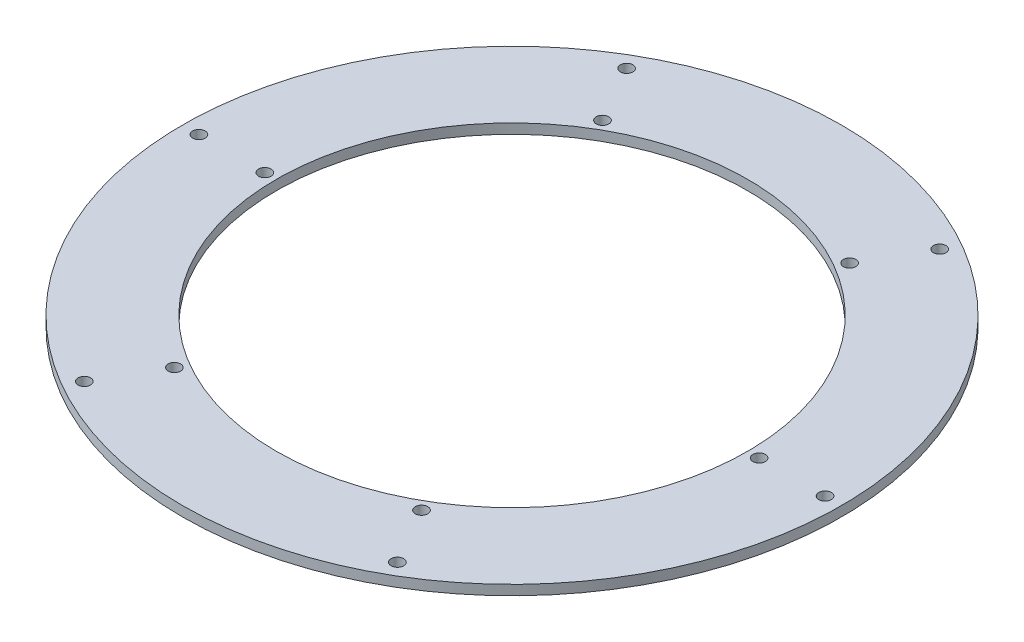
from build123d import *

# Parameters (mm, degrees)
IZIM1_R                     = 100
IZIM1_R_2                   = 71.5
Y_KSEKLIK_EKSTR_ZYON1_DEPTH = 3
IZIM2_R                     = 1.9
KES_EKSTR_ZYON1_DEPTH       = 142.453172464
DAIRESEL_KAPLAMA1_COUNT     = 6


with BuildPart() as part:
    # Çizim1 → Yükseklik-Ekstrüzyon1 (new body)
    with BuildSketch(Plane(origin=(0, 0, 0), x_dir=(1, 0, 0), z_dir=(0, 1, 0))):
        with Locations(Location((0, 0, 0), (0, 0, 270))):
            Circle(IZIM1_R)
        with Locations(Location((0, 0, 0), (0, 0, 270))):
            Circle(IZIM1_R_2, mode=Mode.SUBTRACT)
    extrude(amount=Y_KSEKLIK_EKSTR_ZYON1_DEPTH)

    # Çizim2 → Kes-Ekstrüzyon1 (cut, symmetric)
    with BuildSketch(Plane(origin=(0, 3, 0), x_dir=(1, 0, 0), z_dir=(0, 1, 0))):
        with Locations(Location((-95, 0, 0), (0, 0, 270))):
            Circle(IZIM2_R)
        with Locations(Location((-75, 0, 0), (0, 0, 270))):
            Circle(IZIM2_R)
    kes_ekstr_zyon1 = extrude(amount=KES_EKSTR_ZYON1_DEPTH, both=True, mode=Mode.SUBTRACT)

    # Dairesel Kaplama1: Kes-Ekstrüzyon1 ×6 about axis
    dairesel_kaplama1_axis = Axis((0, 0, 0), (0, 1, 0))
    for i in range(1, DAIRESEL_KAPLAMA1_COUNT):
        add(kes_ekstr_zyon1.rotate(dairesel_kaplama1_axis, i * 360 / DAIRESEL_KAPLAMA1_COUNT), mode=Mode.SUBTRACT)


solid = part.part
